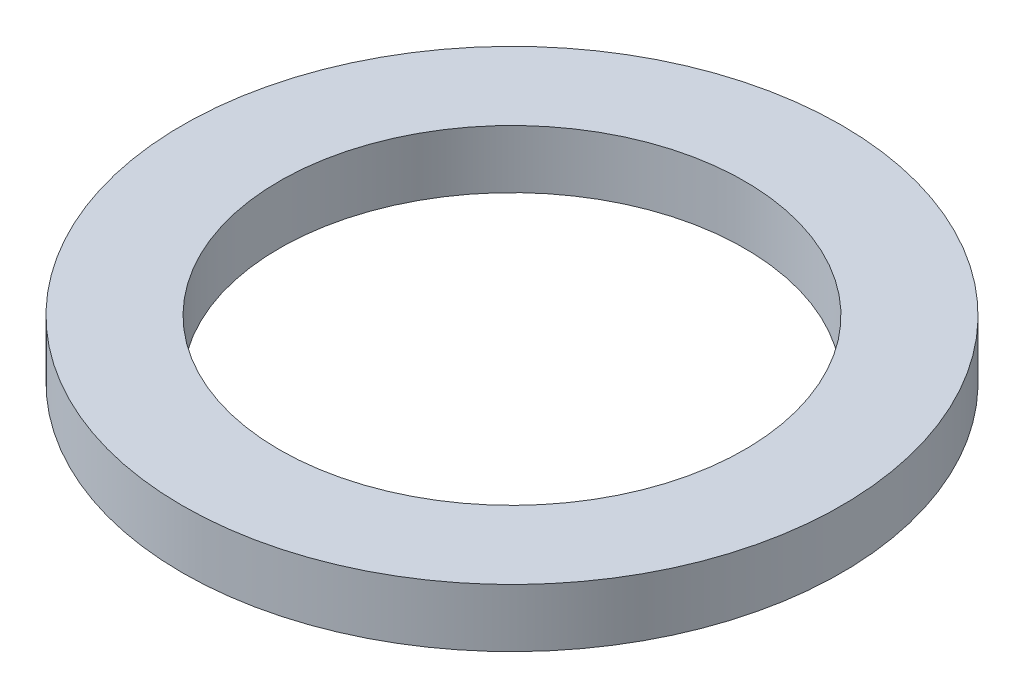
from build123d import *

# Parameters (mm, degrees)
SKETCH1_R           = 8.5
SKETCH1_R_2         = 6
BOSS_EXTRUDE1_DEPTH = 1.5


with BuildPart() as part:
    # Sketch1 → Boss-Extrude1 (new body)
    with BuildSketch(Plane(origin=(0, 0, 0), x_dir=(1, 0, 0), z_dir=(0, 1, 0))):
        with Locations(Location((0, 0, 0), (0, 0, 270))):
            Circle(SKETCH1_R)
        with Locations(Location((0, 0, 0), (0, 0, 270))):
            Circle(SKETCH1_R_2, mode=Mode.SUBTRACT)
    extrude(amount=BOSS_EXTRUDE1_DEPTH)


solid = part.part
